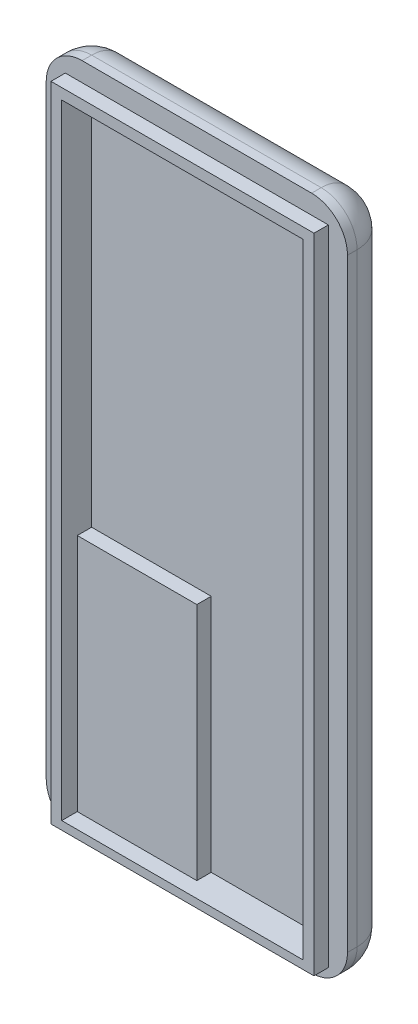
from build123d import *

# Parameters (mm, degrees)
SKETCH_1_W          = 25.2
SKETCH_1_H          = 56.5
EXTRUDE_1_DEPTH     = 5
SKETCH_2_W          = 25.2
SKETCH_2_H          = 56.5
SKETCH_2_W_2        = 22
SKETCH_2_H_2        = 53.8
CUT_EXTRUDE_1_DEPTH = 1.3
SKETCH_3_W          = 20.2
SKETCH_3_H          = 52.2
CUT_EXTRUDE_2_DEPTH = 2.6
SKETCH_4_W          = 0.1
SKETCH_4_H          = 53.8
CUT_EXTRUDE_3_DEPTH = 62.434599372
SKETCH_5_W          = 25.2
SKETCH_5_H          = 56.5
EXTRUDE_2_DEPTH     = 0.1
SKETCH_6_W          = 10
SKETCH_6_H          = 20
EXTRUDE_3_DEPTH     = 1.2
FILLET_1_R          = 3


with BuildPart() as part:
    # Эскиз1 → Бобышка-Вытянуть1 (new body)
    with BuildSketch(Plane.XY):
        with Locations((12.6, 28.25)):
            Rectangle(SKETCH_1_W, SKETCH_1_H)
    extrude(amount=EXTRUDE_1_DEPTH)

    # Эскиз2 → Вырез-Вытянуть1 (cut)
    with BuildSketch(Plane.XY.offset(5)):
        with Locations((12.6, 28.25)):
            Rectangle(SKETCH_2_W, SKETCH_2_H)
        with Locations((12.6, 28)):
            Rectangle(SKETCH_2_W_2, SKETCH_2_H_2, mode=Mode.SUBTRACT)
    extrude(amount=-CUT_EXTRUDE_1_DEPTH, mode=Mode.SUBTRACT)

    # Эскиз3 → Вырез-Вытянуть2 (cut)
    with BuildSketch(Plane.XY.offset(5)):
        with Locations((12.6, 27.9)):
            Rectangle(SKETCH_3_W, SKETCH_3_H)
    extrude(amount=-CUT_EXTRUDE_2_DEPTH, mode=Mode.SUBTRACT)

    # Эскиз4 → Вырез-Вытянуть3 (cut, through all)
    with BuildSketch(Plane.ZY.offset(-1.6)):
        with Locations((4.95, 28)):
            Rectangle(SKETCH_4_W, SKETCH_4_H)
    extrude(amount=-CUT_EXTRUDE_3_DEPTH, mode=Mode.SUBTRACT)

    # Эскиз5 → Бобышка-Вытянуть2 (add)
    with BuildSketch(Plane(origin=(0, 0, 0), x_dir=(-1, 0, 0), z_dir=(0, 0, -1))):
        with Locations((-12.6, 28.25)):
            Rectangle(SKETCH_5_W, SKETCH_5_H)
    extrude(amount=EXTRUDE_2_DEPTH)

    # Эскиз6 → Бобышка-Вытянуть3 (add)
    with BuildSketch(Plane.XY.offset(2.4)):
        with Locations((7.5, 11.8)):
            Rectangle(SKETCH_6_W, SKETCH_6_H)
    extrude(amount=EXTRUDE_3_DEPTH)

    # Скругление1
    fillet_1_edges = [part.edges().sort_by_distance(p)[0] for p in [
        (0, 56.5, 1.8),
        (25.2, 56.5, 1.8),
        (25.2, 0, 1.8),
        (0, 0, 1.8),
        (25.2, 28.25, -0.1),
        (12.6, 0, -0.1),
        (0, 28.25, -0.1),
        (12.6, 56.5, -0.1),
    ]]
    fillet(fillet_1_edges, radius=FILLET_1_R)


solid = part.part
